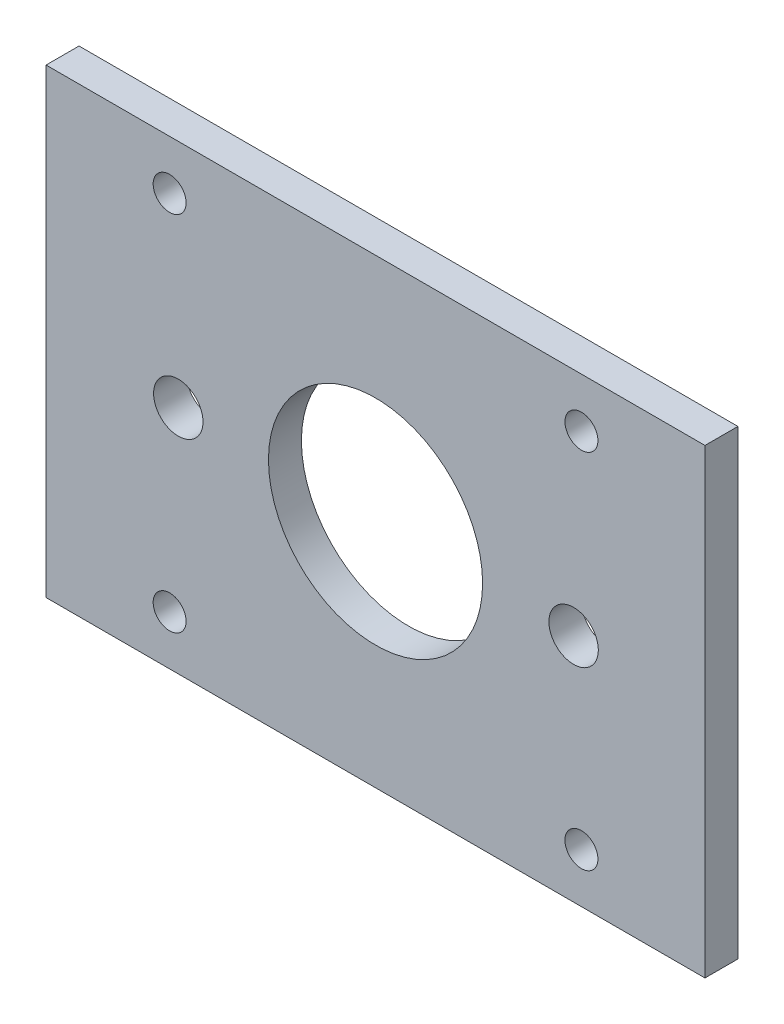
from build123d import *

# Parameters (mm, degrees)
SKETCH_1_W                  = 80
SKETCH_1_H                  = 56
SKETCH_1_R                  = 13
EXTRUDE_1_DEPTH             = 4
SKETCH_2_R                  = 2
CUT_EXTRUDE_1_DEPTH         = 100
PATTERN_LINEAR_1_COUNT      = 2
PATTERN_LINEAR_1_PITCH      = 44
PATTERN_LINEAR_1_COUNT_DIR2 = 2
PATTERN_LINEAR_1_PITCH_DIR2 = 50
SKETCH_3_R                  = 3
CUT_EXTRUDE_2_DEPTH         = 50


with BuildPart() as part:
    # 草图1 → 凸台-拉伸1 (new body)
    with BuildSketch(Plane.XY):
        with Locations((0, 7)):
            Rectangle(SKETCH_1_W, SKETCH_1_H)
        with Locations((0, 7)):
            Circle(SKETCH_1_R, mode=Mode.SUBTRACT)
    extrude(amount=EXTRUDE_1_DEPTH)

    # 草图2 → 切除-拉伸1 (cut)
    with BuildSketch(Plane.XY.offset(4)):
        with Locations((-25, -15)):
            Circle(SKETCH_2_R)
    cut_extrude_1 = extrude(amount=-CUT_EXTRUDE_1_DEPTH, mode=Mode.SUBTRACT)

    # 阵列(线性)1: Cut-Extrude 1 2 × 2
    with Locations(*[(j * PATTERN_LINEAR_1_PITCH_DIR2, i * PATTERN_LINEAR_1_PITCH, 0) for i in range(PATTERN_LINEAR_1_COUNT) for j in range(PATTERN_LINEAR_1_COUNT_DIR2) if (i, j) != (0, 0)]):
        add(cut_extrude_1, mode=Mode.SUBTRACT)

    # 草图3 → 切除-拉伸2 (cut)
    with BuildSketch(Plane.XY.offset(4)):
        with Locations((24.051141157, 7)):
            Circle(SKETCH_3_R)
        with Locations((-23.948858843, 7)):
            Circle(SKETCH_3_R)
    extrude(amount=-CUT_EXTRUDE_2_DEPTH, mode=Mode.SUBTRACT)


solid = part.part
